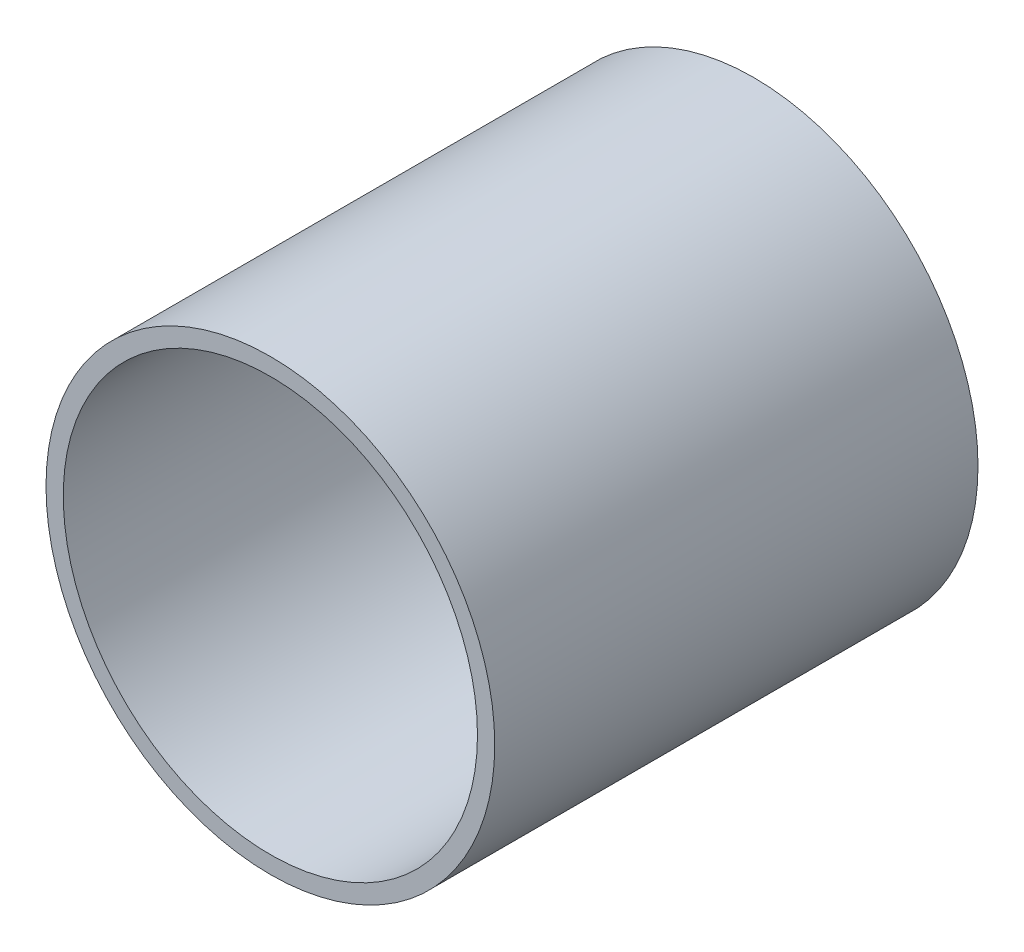
from build123d import *

# Parameters (mm, degrees)
SKETCH1_R           = 32.5
SKETCH1_R_2         = 30
BOSS_EXTRUDE1_DEPTH = 70


with BuildPart() as part:
    # Sketch1 → Boss-Extrude1 (new body)
    with BuildSketch(Plane.XY):
        Circle(SKETCH1_R)
        Circle(SKETCH1_R_2, mode=Mode.SUBTRACT)
    extrude(amount=BOSS_EXTRUDE1_DEPTH)


solid = part.part
